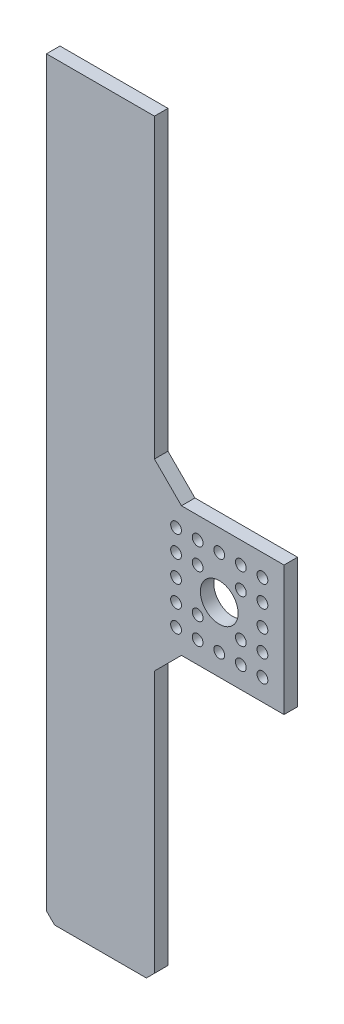
from build123d import *

# Parameters (mm, degrees)
SKETCH1_R           = 7
SKETCH1_R_2         = 2
BOSS_EXTRUDE1_DEPTH = 5
CHAMFER2_SIZE       = 3
CHAMFER3_SIZE       = 10


with BuildPart() as part:
    # Sketch1 → Boss-Extrude1 (new body)
    with BuildSketch(Plane.XY):
        Polygon((0, 0), (0, -278), (40, -278), (40, -168), (88, -168), (88, -120), (40, -120), (40, 0), align=None)
        with Locations((64, -144)):
            Circle(SKETCH1_R, mode=Mode.SUBTRACT)
        with Locations((48, -128)):
            Circle(SKETCH1_R_2, mode=Mode.SUBTRACT)
        with Locations((56, -128)):
            Circle(SKETCH1_R_2, mode=Mode.SUBTRACT)
        with Locations((64, -128)):
            Circle(SKETCH1_R_2, mode=Mode.SUBTRACT)
        with Locations((72, -128)):
            Circle(SKETCH1_R_2, mode=Mode.SUBTRACT)
        with Locations((80, -128)):
            Circle(SKETCH1_R_2, mode=Mode.SUBTRACT)
        with Locations((56, -136)):
            Circle(SKETCH1_R_2, mode=Mode.SUBTRACT)
        with Locations((72, -136)):
            Circle(SKETCH1_R_2, mode=Mode.SUBTRACT)
        with Locations((80, -136)):
            Circle(SKETCH1_R_2, mode=Mode.SUBTRACT)
        with Locations((80, -144)):
            Circle(SKETCH1_R_2, mode=Mode.SUBTRACT)
        with Locations((56, -152)):
            Circle(SKETCH1_R_2, mode=Mode.SUBTRACT)
        with Locations((72, -152)):
            Circle(SKETCH1_R_2, mode=Mode.SUBTRACT)
        with Locations((80, -152)):
            Circle(SKETCH1_R_2, mode=Mode.SUBTRACT)
        with Locations((56, -160)):
            Circle(SKETCH1_R_2, mode=Mode.SUBTRACT)
        with Locations((64, -160)):
            Circle(SKETCH1_R_2, mode=Mode.SUBTRACT)
        with Locations((72, -160)):
            Circle(SKETCH1_R_2, mode=Mode.SUBTRACT)
        with Locations((80, -160)):
            Circle(SKETCH1_R_2, mode=Mode.SUBTRACT)
        with Locations((48, -136)):
            Circle(SKETCH1_R_2, mode=Mode.SUBTRACT)
        with Locations((48, -144)):
            Circle(SKETCH1_R_2, mode=Mode.SUBTRACT)
        with Locations((48, -152)):
            Circle(SKETCH1_R_2, mode=Mode.SUBTRACT)
        with Locations((48, -160)):
            Circle(SKETCH1_R_2, mode=Mode.SUBTRACT)
    extrude(amount=BOSS_EXTRUDE1_DEPTH)

    # Chamfer2
    chamfer2_edges = [part.edges().sort_by_distance(p)[0] for p in [
        (40, -278, 2.5),
        (0, -278, 2.5),
    ]]
    chamfer(chamfer2_edges, length=CHAMFER2_SIZE)

    # Chamfer3
    chamfer3_edges = [part.edges().sort_by_distance(p)[0] for p in [
        (40, -120, 2.5),
        (40, -168, 2.5),
    ]]
    chamfer(chamfer3_edges, length=CHAMFER3_SIZE)


solid = part.part
